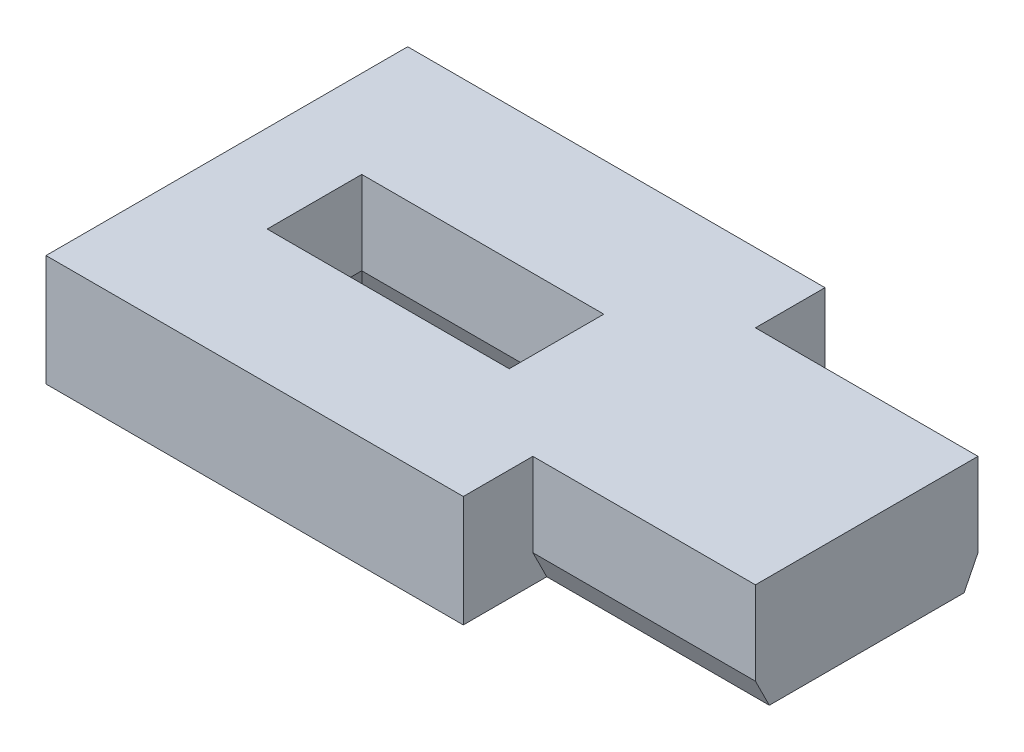
from build123d import *
from OCP.BRepFilletAPI import BRepFilletAPI_MakeChamfer

# Parameters (mm, degrees)
SKETCH1_W           = 15
SKETCH1_H           = 13
SKETCH1_W_2         = 8.7
SKETCH1_H_2         = 3.4
BOSS_EXTRUDE1_DEPTH = 4
SKETCH2_W           = 8
SKETCH2_H           = 8
BOSS_EXTRUDE3_DEPTH = 4
CHAMFER1_SIZE       = 1
CHAMFER1_SIZE2      = 0.5
CHAMFER2_SIZE       = 0.5
CHAMFER2_SIZE2      = 1


with BuildPart() as part:
    # Sketch1 → Boss-Extrude1 (new body)
    with BuildSketch(Plane(origin=(0, 0, 0), x_dir=(1, 0, 0), z_dir=(0, 1, 0))):
        Rectangle(SKETCH1_W, SKETCH1_H)
        Rectangle(SKETCH1_W_2, SKETCH1_H_2, mode=Mode.SUBTRACT)
    extrude(amount=BOSS_EXTRUDE1_DEPTH)

    # Sketch2 → Boss-Extrude3 (add)
    with BuildSketch(Plane(origin=(0, 0, 0), x_dir=(1, 0, 0), z_dir=(0, 1, 0))):
        with Locations((11.5, 0)):
            Rectangle(SKETCH2_W, SKETCH2_H)
    extrude(amount=BOSS_EXTRUDE3_DEPTH)

    # Chamfer1: one chamfer whose edges measure the first distance from different faces: ONE call of the kernel's chamfer builder (chamfer() names one face for all edges)
    chamfer1_edges_1 = [part.edges().sort_by_distance(p)[0] for p in [
        (4.35, 0, 0),
    ]]
    chamfer1_side_1 = [part.faces().sort_by_distance(p)[0] for p in [
        (4.35, 2, 0),
    ]]
    chamfer1_edges_2 = [part.edges().sort_by_distance(p)[0] for p in [
        (0, 0, -1.7),
    ]]
    chamfer1_side_2 = [part.faces().sort_by_distance(p)[0] for p in [
        (0, 2, -1.7),
    ]]
    chamfer1_edges_3 = [part.edges().sort_by_distance(p)[0] for p in [
        (-4.35, 0, 0),
    ]]
    chamfer1_side_3 = [part.faces().sort_by_distance(p)[0] for p in [
        (-4.35, 2, 0),
    ]]
    chamfer1_edges_4 = [part.edges().sort_by_distance(p)[0] for p in [
        (0, 0, 1.7),
    ]]
    chamfer1_side_4 = [part.faces().sort_by_distance(p)[0] for p in [
        (0, 2, 1.7),
    ]]
    chamfer1 = BRepFilletAPI_MakeChamfer(part.part.solid().wrapped)
    for e in chamfer1_edges_1:
        chamfer1.Add(CHAMFER1_SIZE, CHAMFER1_SIZE2, e.wrapped, chamfer1_side_1[0].wrapped)  # the first distance lies on this face
    for e in chamfer1_edges_2:
        chamfer1.Add(CHAMFER1_SIZE, CHAMFER1_SIZE2, e.wrapped, chamfer1_side_2[0].wrapped)  # the first distance lies on this face
    for e in chamfer1_edges_3:
        chamfer1.Add(CHAMFER1_SIZE, CHAMFER1_SIZE2, e.wrapped, chamfer1_side_3[0].wrapped)  # the first distance lies on this face
    for e in chamfer1_edges_4:
        chamfer1.Add(CHAMFER1_SIZE, CHAMFER1_SIZE2, e.wrapped, chamfer1_side_4[0].wrapped)  # the first distance lies on this face
    add(Compound.cast(chamfer1.Shape()), mode=Mode.REPLACE)

    # Chamfer2
    chamfer2_edges = [part.edges().sort_by_distance(p)[0] for p in [
        (11.5, 0, 4),
        (11.5, 0, -4),
    ]]
    chamfer2_side = [part.faces().sort_by_distance(p)[0] for p in [
        (5.114196896, 0, 0),
    ]]
    chamfer(chamfer2_edges, length=CHAMFER2_SIZE, length2=CHAMFER2_SIZE2, reference=chamfer2_side[0])


solid = part.part
